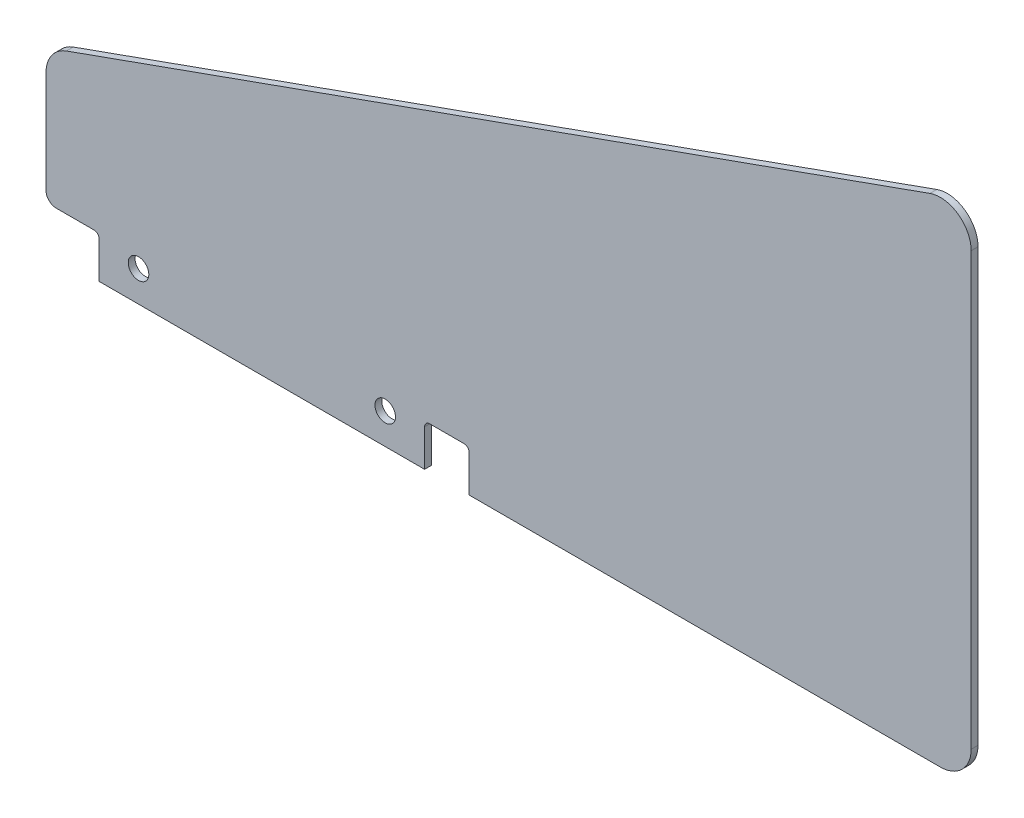
from build123d import *

# Parameters (mm, degrees)
MODEL_R                 = 1.5
SALIENTE_EXTRUIR1_DEPTH = 1


with BuildPart() as part:
    # Model → Saliente-Extruir1 (new body)
    with BuildSketch(Plane.XY):
        with BuildLine():
            Line((147.399890085, 168.7618816), (216.149890085, 168.7618816))
            ThreePointArc((216.149890085, 168.7618816), (219.3318706, 170.079901084), (220.649890085, 173.2618816))
            Line((220.649890085, 173.2618816), (220.649890085, 236.2618816))
            ThreePointArc((220.649890085, 236.2618816), (218.74210805, 239.940251622), (214.636376298, 240.499720202))
            Line((214.636376298, 240.499720202), (88.636376298, 195.499720202))
            ThreePointArc((88.636376298, 195.499720202), (86.471520063, 193.854099565), (85.649890085, 191.2618816))
            Line((85.649890085, 191.2618816), (85.649890085, 176.3868816))
            ThreePointArc((85.649890085, 176.3868816), (86.089229913, 175.326221428), (87.149890085, 174.8868816))
            Line((87.149890085, 174.8868816), (92.649890085, 174.8868816))
            ThreePointArc((92.649890085, 174.8868816), (93.180220171, 174.667211686), (93.399890085, 174.1368816))
            Line((93.399890085, 174.1368816), (93.399890085, 168.7618816))
            Line((93.399890085, 168.7618816), (140.899890085, 168.7618816))
            Line((140.899890085, 168.7618816), (140.899890085, 174.1368816))
            ThreePointArc((140.899890085, 174.1368816), (141.119559999, 174.667211686), (141.649890085, 174.8868816))
            Line((141.649890085, 174.8868816), (146.649890085, 174.8868816))
            ThreePointArc((146.649890085, 174.8868816), (147.180220171, 174.667211686), (147.399890085, 174.1368816))
            Line((147.399890085, 174.1368816), (147.399890085, 168.7618816))
        make_face()
        with Locations((99.149890085, 173.2618816)):
            Circle(MODEL_R, mode=Mode.SUBTRACT)
        with Locations((135.149890085, 173.2618816)):
            Circle(MODEL_R, mode=Mode.SUBTRACT)
    extrude(amount=SALIENTE_EXTRUIR1_DEPTH)


solid = part.part
